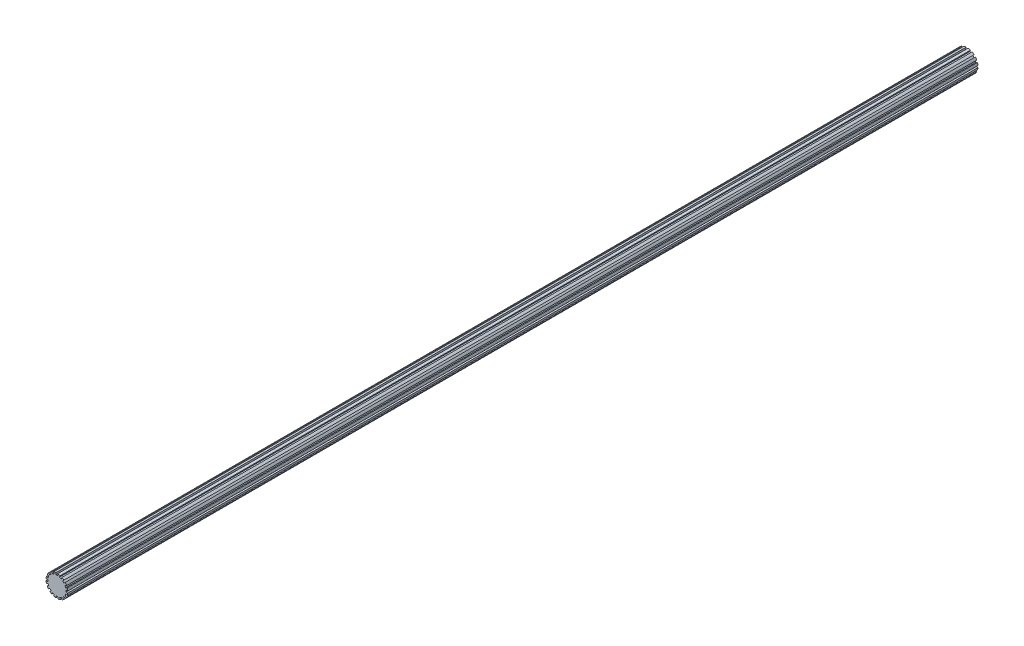
from build123d import *

# Parameters (mm, degrees)
SKETCH1_R           = 3
BOSS_EXTRUDE1_DEPTH = 250
CUT_EXTRUDE2_DEPTH  = 251.035997408


with BuildPart() as part:
    # Sketch1 → Boss-Extrude1 (new body)
    with BuildSketch(Plane.XY):
        Circle(SKETCH1_R)
    extrude(amount=BOSS_EXTRUDE1_DEPTH)

    # Sketch2 → Cut-Extrude2 (cut, through all)
    with BuildSketch(Plane.XY.offset(250)):
        with BuildLine():
            ThreePointArc((2.857977755, 0.912120142), (2.771638598, 1.148050297), (2.665861788, 1.375929113))
            Line((2.665861788, 1.375929113), (2.21589064, 1.189544961))
            Line((2.21589064, 1.189544961), (2.408006606, 0.725735989))
            Line((2.408006606, 0.725735989), (2.857977755, 0.912120142))
        make_face()
        with BuildLine():
            ThreePointArc((2.291373885, 1.936389867), (2.121320344, 2.121320344), (1.936389867, 2.291373885))
            Line((1.936389867, 2.291373885), (1.59199686, 1.946980878))
            Line((1.59199686, 1.946980878), (1.946980878, 1.59199686))
            Line((1.946980878, 1.59199686), (2.291373885, 1.936389867))
        make_face()
        with BuildLine():
            ThreePointArc((0.251011607, 2.989480419), (0.125615971, 2.997368951), (0, 3))
            Line((0, 3), (0, 2.502435157))
            Line((0, 2.502435157), (0.251011607, 2.502435157))
            Line((0.251011607, 2.502435157), (0.251011607, 2.989480419))
        make_face()
        with BuildLine():
            Line((0, 2.502435157), (0, 3))
            ThreePointArc((0, 3), (-0.125615971, 2.997368951), (-0.251011607, 2.989480419))
            Line((-0.251011607, 2.989480419), (-0.251011607, 2.502435157))
            Line((-0.251011607, 2.502435157), (0, 2.502435157))
        make_face()
        with BuildLine():
            Line((-0.725735989, 2.408006606), (-0.912120142, 2.857977755))
            ThreePointArc((-0.912120142, 2.857977755), (-1.148050297, 2.771638598), (-1.375929113, 2.665861788))
            Line((-1.375929113, 2.665861788), (-1.189544961, 2.21589064))
            Line((-1.189544961, 2.21589064), (-0.725735989, 2.408006606))
        make_face()
        with BuildLine():
            Line((-1.59199686, 1.946980878), (-1.936389867, 2.291373885))
            ThreePointArc((-1.936389867, 2.291373885), (-2.121320344, 2.121320344), (-2.291373885, 1.936389867))
            Line((-2.291373885, 1.936389867), (-1.946980878, 1.59199686))
            Line((-1.946980878, 1.59199686), (-1.59199686, 1.946980878))
        make_face()
        with BuildLine():
            Line((-2.21589064, 1.189544961), (-2.665861788, 1.375929113))
            ThreePointArc((-2.665861788, 1.375929113), (-2.771638598, 1.148050297), (-2.857977755, 0.912120142))
            Line((-2.857977755, 0.912120142), (-2.408006606, 0.725735989))
            Line((-2.408006606, 0.725735989), (-2.21589064, 1.189544961))
        make_face()
        with BuildLine():
            Line((-2.502435157, 0.251011607), (-2.989480419, 0.251011607))
            ThreePointArc((-2.989480419, 0.251011607), (-3, 0), (-2.989480419, -0.251011607))
            Line((-2.989480419, -0.251011607), (-2.502435157, -0.251011607))
            Line((-2.502435157, -0.251011607), (-2.502435157, 0.251011607))
        make_face()
        with BuildLine():
            Line((-2.408006606, -0.725735989), (-2.857977755, -0.912120142))
            ThreePointArc((-2.857977755, -0.912120142), (-2.771638598, -1.148050297), (-2.665861788, -1.375929113))
            Line((-2.665861788, -1.375929113), (-2.21589064, -1.189544961))
            Line((-2.21589064, -1.189544961), (-2.408006606, -0.725735989))
        make_face()
        with BuildLine():
            Line((-1.946980878, -1.59199686), (-2.291373885, -1.936389867))
            ThreePointArc((-2.291373885, -1.936389867), (-2.121320344, -2.121320344), (-1.936389867, -2.291373885))
            Line((-1.936389867, -2.291373885), (-1.59199686, -1.946980878))
            Line((-1.59199686, -1.946980878), (-1.946980878, -1.59199686))
        make_face()
        with BuildLine():
            Line((-1.189544961, -2.21589064), (-1.375929113, -2.665861788))
            ThreePointArc((-1.375929113, -2.665861788), (-1.148050297, -2.771638598), (-0.912120142, -2.857977755))
            Line((-0.912120142, -2.857977755), (-0.725735989, -2.408006606))
            Line((-0.725735989, -2.408006606), (-1.189544961, -2.21589064))
        make_face()
        with BuildLine():
            Line((-0.251011607, -2.502435157), (-0.251011607, -2.989480419))
            ThreePointArc((-0.251011607, -2.989480419), (0, -3), (0.251011607, -2.989480419))
            Line((0.251011607, -2.989480419), (0.251011607, -2.502435157))
            Line((0.251011607, -2.502435157), (-0.251011607, -2.502435157))
        make_face()
        with BuildLine():
            ThreePointArc((0.912120142, -2.857977755), (1.148050297, -2.771638598), (1.375929113, -2.665861788))
            Line((1.375929113, -2.665861788), (1.189544961, -2.21589064))
            Line((1.189544961, -2.21589064), (0.725735989, -2.408006606))
            Line((0.725735989, -2.408006606), (0.912120142, -2.857977755))
        make_face()
        with BuildLine():
            ThreePointArc((1.936389867, -2.291373885), (2.121320344, -2.121320344), (2.291373885, -1.936389867))
            Line((2.291373885, -1.936389867), (1.946980878, -1.59199686))
            Line((1.946980878, -1.59199686), (1.59199686, -1.946980878))
            Line((1.59199686, -1.946980878), (1.936389867, -2.291373885))
        make_face()
        with BuildLine():
            ThreePointArc((2.665861788, -1.375929113), (2.771638598, -1.148050297), (2.857977755, -0.912120142))
            Line((2.857977755, -0.912120142), (2.408006606, -0.725735989))
            Line((2.408006606, -0.725735989), (2.21589064, -1.189544961))
            Line((2.21589064, -1.189544961), (2.665861788, -1.375929113))
        make_face()
        with BuildLine():
            ThreePointArc((3, 0), (2.997368951, 0.125615971), (2.989480419, 0.251011607))
            Line((2.989480419, 0.251011607), (2.502435157, 0.251011607))
            Line((2.502435157, 0.251011607), (2.502435157, -0.251011607))
            Line((2.502435157, -0.251011607), (2.989480419, -0.251011607))
            ThreePointArc((2.989480419, -0.251011607), (2.997368951, -0.125615971), (3, 0))
        make_face()
        with BuildLine():
            ThreePointArc((1.375929113, 2.665861788), (1.148050297, 2.771638598), (0.912120142, 2.857977755))
            Line((0.912120142, 2.857977755), (0.725735989, 2.408006606))
            Line((0.725735989, 2.408006606), (1.189544961, 2.21589064))
            Line((1.189544961, 2.21589064), (1.375929113, 2.665861788))
        make_face()
    extrude(amount=-CUT_EXTRUDE2_DEPTH, mode=Mode.SUBTRACT)


solid = part.part
